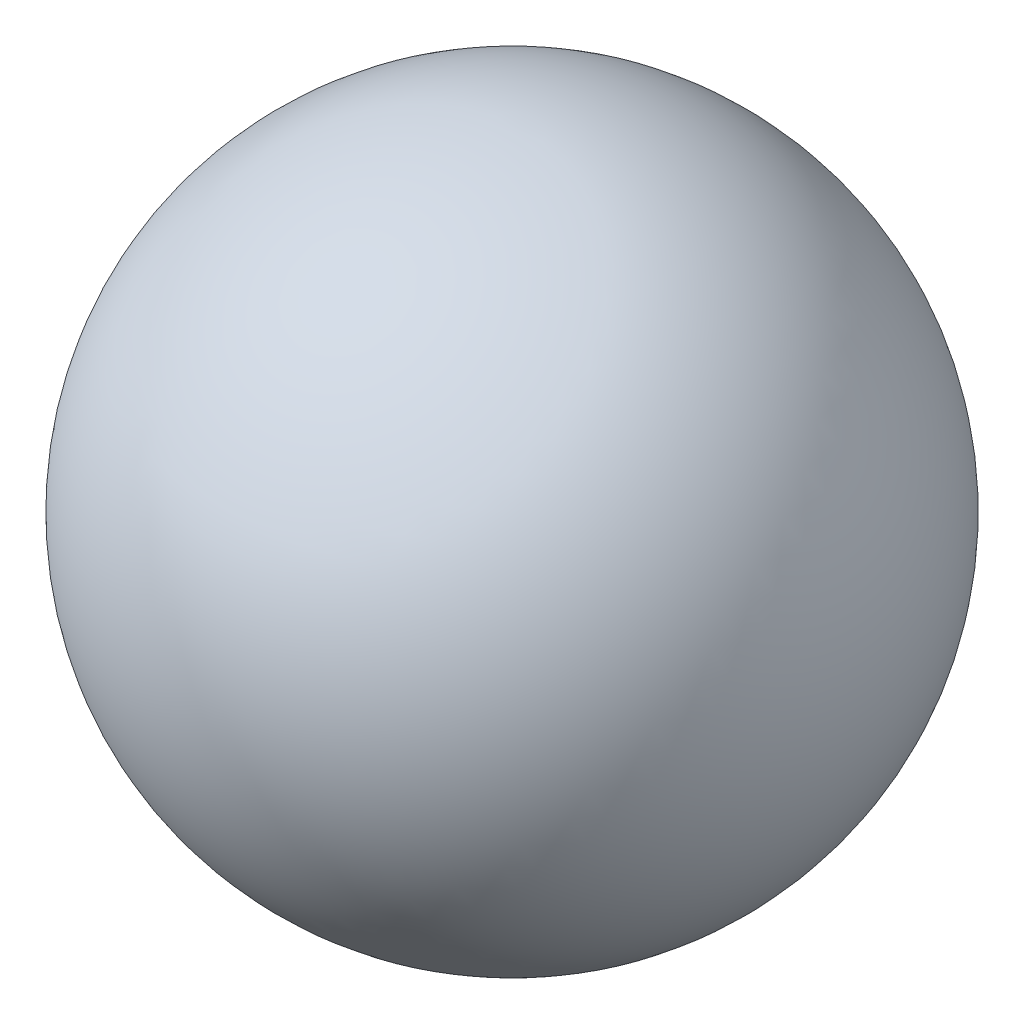
from build123d import *


with BuildPart() as part:
    # Sketch1 → Revolve1 (revolve)
    with BuildSketch(Plane.XY):
        with BuildLine():
            Line((0, 24.5), (0, -24.5))
            ThreePointArc((0, -24.5), (-24.5, 0), (0, 24.5))
        make_face()
    revolve(axis=Axis((0, 24.5, 0), (0, -1, 0)))


solid = part.part
